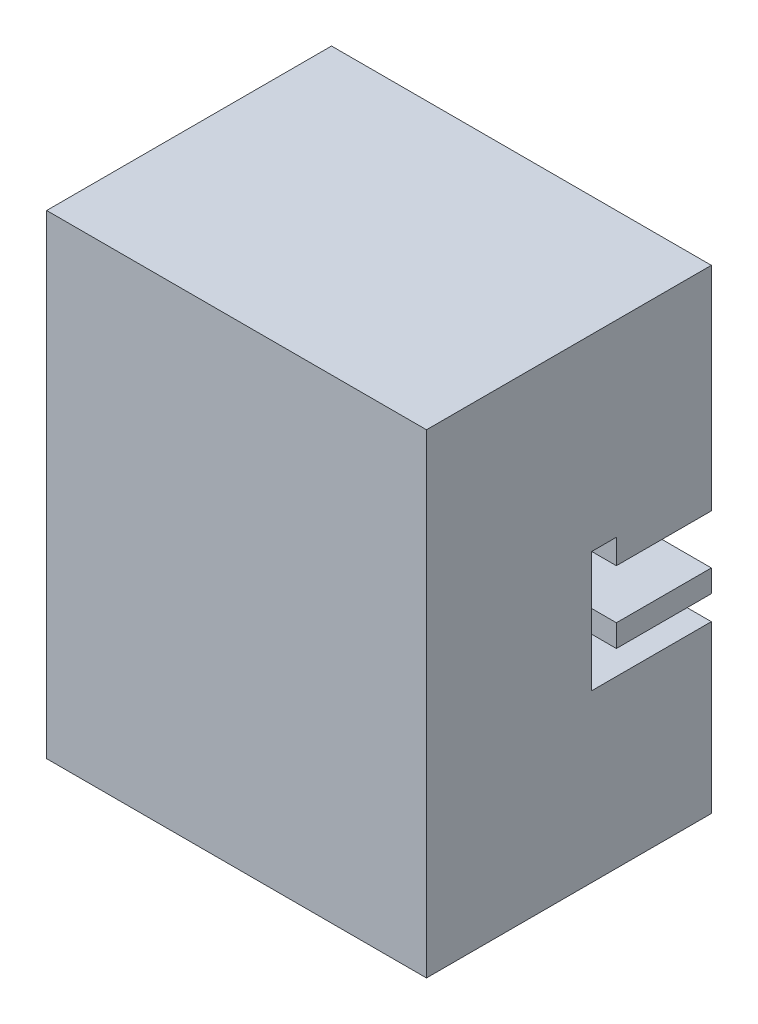
from build123d import *

# Parameters (mm, degrees)
SKETCH1_W           = 40
SKETCH1_H           = 50
BOSS_EXTRUDE1_DEPTH = 30
CUT_EXTRUDE1_REACH  = 72.711
CUT_EXTRUDE2_REACH  = 72.711


with BuildPart() as part:
    # Sketch1 → Boss-Extrude1 (new body)
    with BuildSketch(Plane.XY):
        with Locations((20, 25)):
            Rectangle(SKETCH1_W, SKETCH1_H)
    extrude(amount=BOSS_EXTRUDE1_DEPTH)

    # Sketch2 → Cut-Extrude1 (cut, up to next)
    with BuildSketch(Plane.ZY, mode=Mode.PRIVATE) as cut_extrude1_sk1:
        Polygon((0, 27.6), (10, 27.6), (10, 30.2), (12.6, 30.2), (12.6, 19.8), (10, 19.8), (10, 22.4), (0, 22.4), align=None)
    cut_extrude1_tool1 = extrude(cut_extrude1_sk1.sketch, amount=-CUT_EXTRUDE1_REACH, mode=Mode.PRIVATE) & part.part
    add(cut_extrude1_tool1.solids().sort_by_distance((0, 25, 7.155263))[0], mode=Mode.SUBTRACT)

    # Cut-Extrude2: up to this face of the body (flat: up to its plane)
    cut_extrude2_end = Plane(part.part.faces().sort_by_distance((20, 25, 12.6))[0])
    # Sketch3 → Cut-Extrude2 (cut, up to the picked face)
    with BuildSketch(Plane(origin=(0, 0, 0), x_dir=(-1, 0, 0), z_dir=(0, 0, -1)), mode=Mode.PRIVATE) as cut_extrude2_sk1:
        Polygon((-25.05, 27.6), (-14.95, 27.6), (-14.95, 20.05), (0, 20.05), (0, 17.5), (-40, 17.5), (-40, 20.05), (-25.05, 20.05), align=None)
    cut_extrude2_tool1 = split(extrude(cut_extrude2_sk1.sketch, amount=-CUT_EXTRUDE2_REACH, mode=Mode.PRIVATE), bisect_by=cut_extrude2_end, keep=Keep.BOTH, mode=Mode.PRIVATE)
    add(cut_extrude2_tool1.solids().sort_by(Axis((20, 20.935319, 0), (0, 0, 1)))[0], mode=Mode.SUBTRACT)


with BuildPart() as cut_extrude2_piece_1:
    # of the separate pieces the step leaves, piece 1, a body of its own (cut_extrude2_pieces)
    add(part.part.solids().sort_by_distance((0, 0, 0))[0])


with BuildPart() as cut_extrude2_piece_2:
    # of the separate pieces the step leaves, piece 2, a body of its own (cut_extrude2_pieces)
    add(part.part.solids().sort_by_distance((0, 20.05, 0))[0])


with BuildPart() as cut_extrude2_piece_3:
    # of the separate pieces the step leaves, piece 3, a body of its own (cut_extrude2_pieces)
    add(part.part.solids().sort_by_distance((40, 20.05, 0))[0])


solid = Compound([cut_extrude2_piece_1.part, cut_extrude2_piece_2.part, cut_extrude2_piece_3.part])
